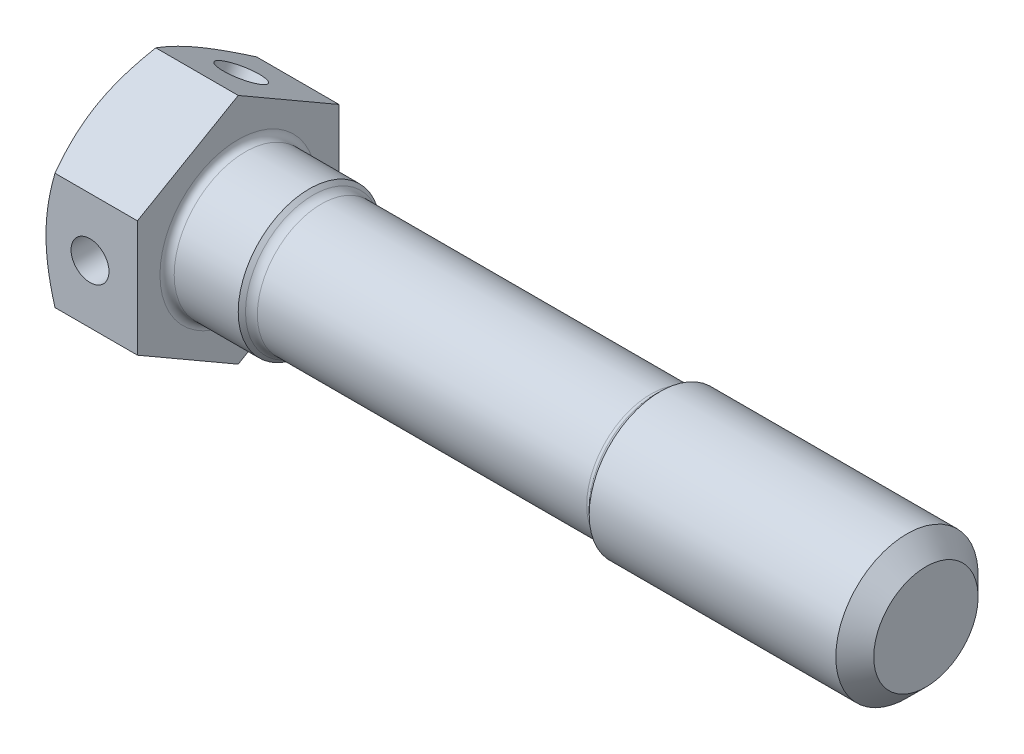
from build123d import *

# Parameters (mm, degrees)
EXTRUDE_1_DEPTH     = 8
SKETCH_3_OUTSIDE_W  = 269.662
SKETCH_3_OUTSIDE_H  = 272.292
SKETCH_3_OUTSIDE_R  = 8
CUT_EXTRUDE_1_DEPTH = 68.265023105
CUT_EXTRUDE_1_DRAFT = -60
FILLET_1_R          = 0.6
SKETCH_4_R          = 1.6
CUT_EXTRUDE_2_DEPTH = 62.231800017
SKETCH_5_R          = 1.75
CUT_EXTRUDE_3_DEPTH = 62.8189561


with BuildPart() as part:
    # Эскиз1 → Повернуть1 (revolve)
    with BuildSketch(Plane.XY, mode=Mode.PRIVATE) as revolve_1_sk:
        with BuildLine():
            Line((0, 0), (0, 6))
            Line((0, 6), (6, 6))
            Line((6, 6), (6.307106781, 5.692893219))
            ThreePointArc((6.307106781, 5.692893219), (6.63153013, 5.476120467), (7.014213562, 5.4))
            Line((7.014213562, 5.4), (34.792893219, 5.4))
            ThreePointArc((34.792893219, 5.4), (34.984234935, 5.438060234), (35.146446609, 5.546446609))
            Line((35.146446609, 5.546446609), (35.6, 6))
            Line((35.6, 6), (56.4, 6))
            Line((56.4, 6), (58, 4.4))
            Line((58, 4.4), (58, 0))
            Line((58, 0), (0, 0))
        make_face()
    revolve(revolve_1_sk.sketch.rotate(Axis((0, 0, 0), (1, 0, 0)), 90), axis=Axis((0, 0, 0), (1, 0, 0)))

    # Эскиз2 → Бобышка-Вытянуть1 (add)
    with BuildSketch(Plane.ZY):
        Polygon((0, -9.814954576), (8.5, -4.907477288), (8.5, 4.907477288), (0, 9.814954576), (-8.5, 4.907477288), (-8.5, -4.907477288), align=None)
    extrude(amount=EXTRUDE_1_DEPTH)


with BuildPart() as cut_extrude_1_tool:
    # Эскиз3 outside → Вырез-Вытянуть1 (with draft: the straight prism first)
    with BuildSketch(Plane.ZY.offset(8)):
        Rectangle(SKETCH_3_OUTSIDE_W, SKETCH_3_OUTSIDE_H)
        Circle(SKETCH_3_OUTSIDE_R, mode=Mode.SUBTRACT)
    extrude(amount=-CUT_EXTRUDE_1_DEPTH)
    # Вырез-Вытянуть1: the draft: its side faces are tilted about the plane it starts from
    cut_extrude_1_sides = [cut_extrude_1_tool.faces().sort_by_distance(p)[0] for p in [
        (26.132511553, -136.146, 0),
        (26.132511553, 0, 134.831),
        (26.132511553, 136.146, 0),
        (26.132511553, 0, -134.831),
        (26.132511553, 0, -8),
    ]]
    draft(cut_extrude_1_sides, Plane.ZY.offset(8), CUT_EXTRUDE_1_DRAFT)


with BuildPart() as part_1:
    add(part.part)

    # Вырез-Вытянуть1: cut by cut_extrude_1_tool
    add(cut_extrude_1_tool.part, mode=Mode.SUBTRACT)

    # Скругление1
    fillet_1_edges = [part_1.edges().sort_by_distance(p)[0] for p in [
        (0, 0, -6),
    ]]
    fillet(fillet_1_edges, radius=FILLET_1_R)

    # Эскиз4 → Вырез-Вытянуть2 (cut, through all)
    with BuildSketch(Plane.XY.offset(8.5)):
        with Locations((-4, 0)):
            Circle(SKETCH_4_R)
    extrude(amount=-CUT_EXTRUDE_2_DEPTH, mode=Mode.SUBTRACT)

    # Эскиз5 → Вырез-Вытянуть3 (cut, through all)
    with BuildSketch(Plane(origin=(0, -7.361215932, 4.25), x_dir=(1, 0, 0), z_dir=(0, -0.8660254037844385, 0.5000000000000004))):
        with Locations(Location((-4, 0, 0), (0, 0, 270))):
            Circle(SKETCH_5_R)
    extrude(amount=-CUT_EXTRUDE_3_DEPTH, mode=Mode.SUBTRACT)


solid = part_1.part
